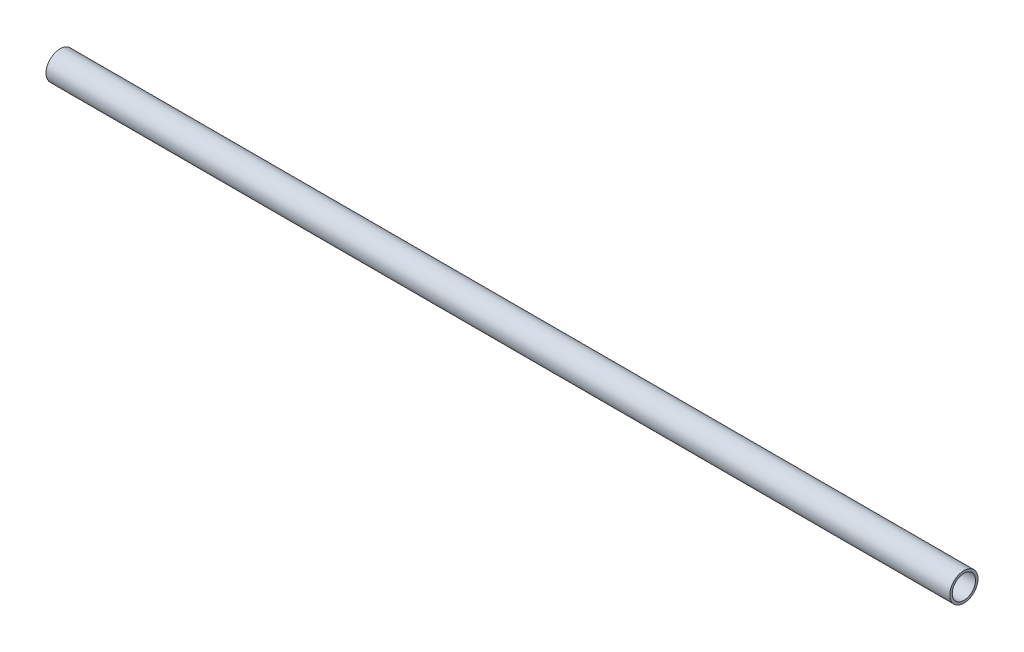
from build123d import *

# Parameters (mm, degrees)
SKETCH1_R           = 9.525
SKETCH1_R_2         = 7.874
BOSS_EXTRUDE1_DEPTH = 304.8


with BuildPart() as part:
    # Sketch1 → Boss-Extrude1 (new, symmetric)
    with BuildSketch(Plane(origin=(0, 0, 0), x_dir=(0, 0, -1), z_dir=(1, 0, 0))):
        with Locations(Location((0, 0, 0), (0, 0, 180))):
            Circle(SKETCH1_R)
        with Locations(Location((0, 0, 0), (0, 0, 180))):
            Circle(SKETCH1_R_2, mode=Mode.SUBTRACT)
    extrude(amount=BOSS_EXTRUDE1_DEPTH, both=True)


solid = part.part
